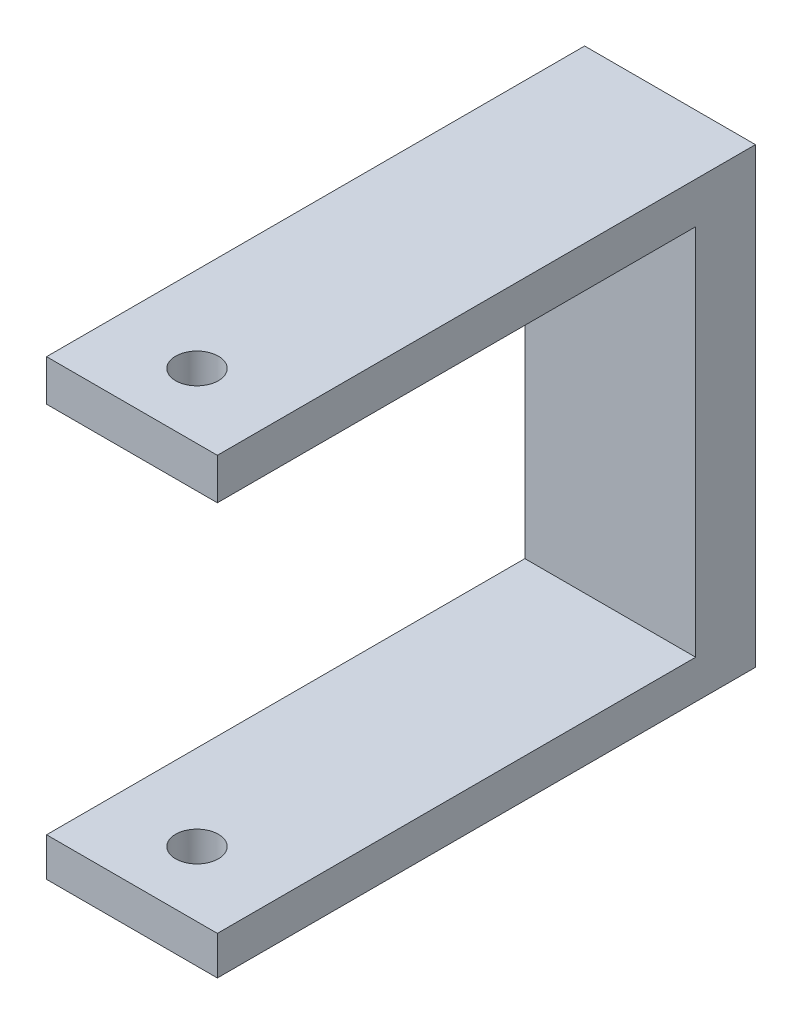
from build123d import *

# Parameters (mm, degrees)
SKETCH1_W           = 20
SKETCH1_H           = 100
BOSS_EXTRUDE1_DEPTH = 53
SKETCH2_W           = 20
SKETCH2_H           = 22.115254232
CUT_EXTRUDE1_DEPTH  = 93
SKETCH3_R           = 2.5
CUT_EXTRUDE2_DEPTH  = 93
SKETCH4_W           = 20
SKETCH4_H           = 7.428579278
CUT_EXTRUDE3_DEPTH  = 93
SKETCH5_W           = 20
SKETCH5_H           = 14.111734172
CUT_EXTRUDE4_DEPTH  = 93
SKETCH6_R           = 2.5
CUT_EXTRUDE5_DEPTH  = 70
SKETCH7_W           = 20
SKETCH7_H           = 53
CUT_EXTRUDE6_DEPTH  = 37


with BuildPart() as part:
    # Sketch1 → Boss-Extrude1 (new body)
    with BuildSketch(Plane(origin=(0, 0, 0), x_dir=(1, 0, 0), z_dir=(0, 1, 0))):
        Rectangle(SKETCH1_W, SKETCH1_H)
    extrude(amount=BOSS_EXTRUDE1_DEPTH)

    # Sketch2 → Cut-Extrude1 (cut)
    with BuildSketch(Plane.XY.offset(50)):
        with Locations((0, 15.581680587)):
            Rectangle(SKETCH2_W, SKETCH2_H)
    extrude(amount=-CUT_EXTRUDE1_DEPTH, mode=Mode.SUBTRACT)

    # Sketch3 → Cut-Extrude2 (cut)
    with BuildSketch(Plane(origin=(0, 53, 0), x_dir=(1, 0, 0), z_dir=(0, 1, 0))):
        with Locations(Location((0, -43.339691346, 0), (0, 0, 270))):
            Circle(SKETCH3_R)
    extrude(amount=-CUT_EXTRUDE2_DEPTH, mode=Mode.SUBTRACT)

    # Sketch4 → Cut-Extrude3 (cut)
    with BuildSketch(Plane.XY.offset(50)):
        with Locations((0, 30.353597342)):
            Rectangle(SKETCH4_W, SKETCH4_H)
    extrude(amount=-CUT_EXTRUDE3_DEPTH, mode=Mode.SUBTRACT)

    # Sketch5 → Cut-Extrude4 (cut)
    with BuildSketch(Plane.XY.offset(50)):
        with Locations((0, 41.123754067)):
            Rectangle(SKETCH5_W, SKETCH5_H)
    extrude(amount=-CUT_EXTRUDE4_DEPTH, mode=Mode.SUBTRACT)

    # Sketch6 → Cut-Extrude5 (cut)
    with BuildSketch(Plane(origin=(0, 53, 0), x_dir=(1, 0, 0), z_dir=(0, 1, 0))):
        with Locations(Location((0, -5.385612406, 0), (0, 0, 270))):
            Circle(SKETCH6_R)
    extrude(amount=-CUT_EXTRUDE5_DEPTH, mode=Mode.SUBTRACT)

    # Sketch7 → Cut-Extrude6 (cut)
    with BuildSketch(Plane.XY.offset(50)):
        with Locations((0, 26.5)):
            Rectangle(SKETCH7_W, SKETCH7_H)
    extrude(amount=-CUT_EXTRUDE6_DEPTH, mode=Mode.SUBTRACT)


solid = part.part
